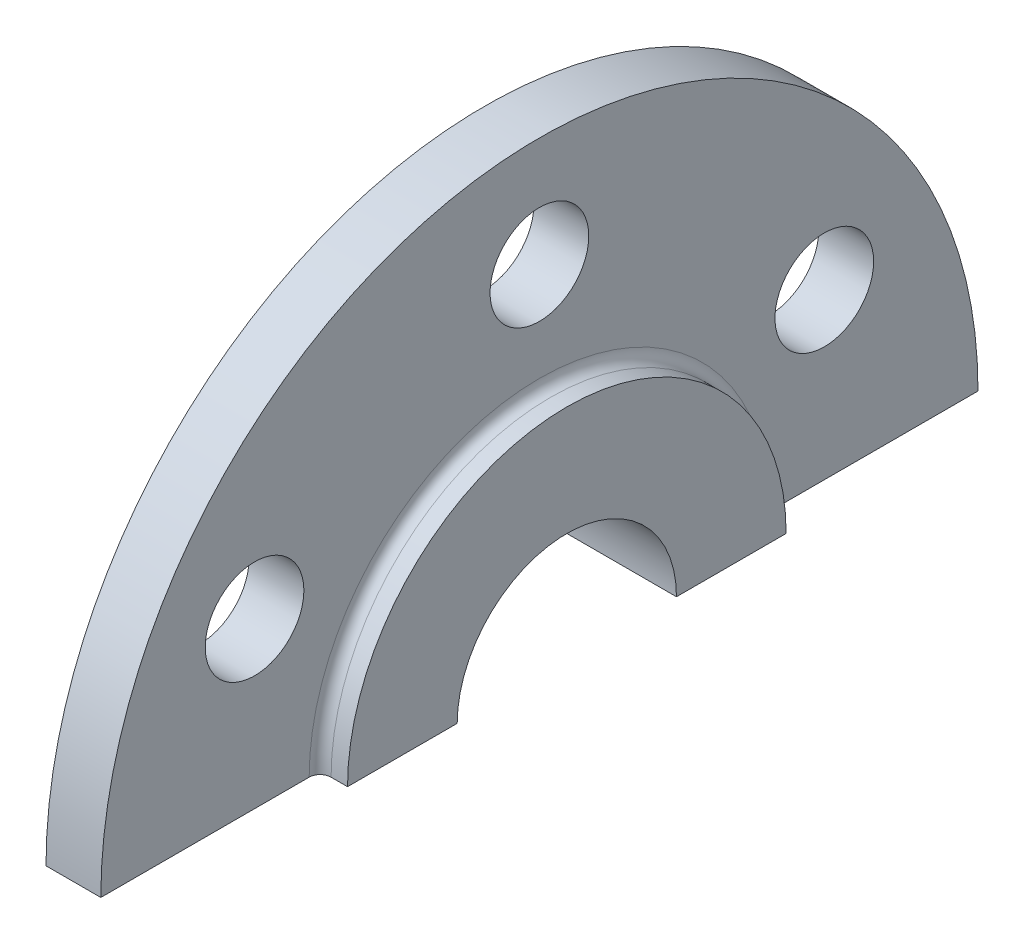
from build123d import *

# Parameters (mm, degrees)
REVOLVE1_ANGLE          = 180
CUT_EXTRUDE1_DEPTH      = 114.578166916
CUT_EXTRUDE1_DEPTH_BACK = 114.578166916
SKETCH3_R               = 9
FILLET1_R               = 2


with BuildPart() as part:
    # Sketch2 → Revolve1 (revolve)
    with BuildSketch(Plane(origin=(0, 0, 0), x_dir=(1, 0, 0), z_dir=(0, 1, 0))):
        Polygon((-5, 80), (0, 80), (0, 20), (-10, 20), (-10, 40), (-5, 40), align=None)
        Polygon((10, 20), (0, 20), (0, 80), (5, 80), (5, 40), (10, 40), align=None)
    revolve(axis=Axis((-0.5, 0, 0), (1, 0, 0)), revolution_arc=REVOLVE1_ANGLE)

    # Sketch3 → Cut-Extrude1 (cut, two sides: drawn at the far end of the back side and taken through both)
    with BuildSketch(Plane(origin=(0, 0, 0), x_dir=(0, 0, -1), z_dir=(1, 0, 0)).offset(-CUT_EXTRUDE1_DEPTH_BACK)):
        with Locations((-51.961524227, 30)):
            Circle(SKETCH3_R)
        with Locations((0, 60)):
            Circle(SKETCH3_R)
        with Locations((51.961524227, 30)):
            Circle(SKETCH3_R)
    extrude(amount=CUT_EXTRUDE1_DEPTH + CUT_EXTRUDE1_DEPTH_BACK, mode=Mode.SUBTRACT)

    # Fillet1
    fillet1_edges = [part.edges().sort_by_distance(p)[0] for p in [
        (5, 40, 0),
        (-5, 40, 0),
    ]]
    fillet(fillet1_edges, radius=FILLET1_R)


solid = part.part
